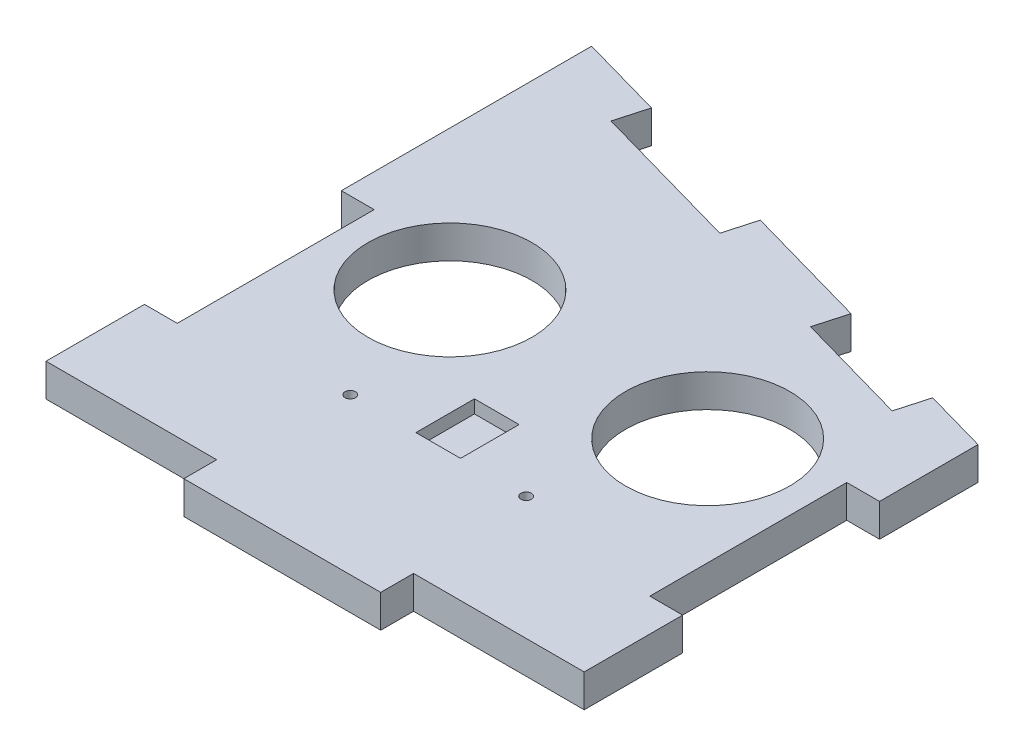
from build123d import *

# Parameters (mm, degrees)
SKETCH1_R           = 7.9375
BOSS_EXTRUDE1_DEPTH = 3.175
SKETCH2_W           = 4.318
SKETCH2_H           = 5.6642
CUT_EXTRUDE1_DEPTH  = 1.27
SKETCH3_R           = 0.508
CUT_EXTRUDE2_DEPTH  = 75.215587445


with BuildPart() as part:
    # Sketch1 → Boss-Extrude1 (new body)
    with BuildSketch(Plane(origin=(0, 0, 0), x_dir=(1, 0, 0), z_dir=(0, 1, 0))):
        Polygon((0, 0), (16.51, 0), (16.51, -3.175), (35.56, -3.175), (35.56, 0), (52.07, 0), (52.07, 9.525), (48.895, 9.525), (48.895, 28.575), (52.07, 28.575), (52.07, 38.1), (45.958497653, 39.823960283), (45.096517511, 36.768209109), (34.095813286, 39.871337619), (34.957793427, 42.927088793), (22.734788732, 46.375009359), (21.872808591, 43.319258185), (7.205202957, 47.456762864), (8.067183099, 50.512514038), (0, 52.788141612), (0, 28.575), (3.175, 28.575), (3.175, 9.525), (0, 9.525), align=None)
        with Locations(Location((13.56995, 25.512426191, 0), (0, 0, 270))):
            Circle(SKETCH1_R, mode=Mode.SUBTRACT)
        with Locations(Location((38.50005, 25.512426191, 0), (0, 0, 270))):
            Circle(SKETCH1_R, mode=Mode.SUBTRACT)
    extrude(amount=BOSS_EXTRUDE1_DEPTH)

    # Sketch2 → Cut-Extrude1 (cut)
    with BuildSketch(Plane(origin=(0, 3.175, 0), x_dir=(1, 0, 0), z_dir=(0, 1, 0))):
        with Locations((26.035, 14.742826191)):
            Rectangle(SKETCH2_W, SKETCH2_H)
    extrude(amount=-CUT_EXTRUDE1_DEPTH, mode=Mode.SUBTRACT)

    # Sketch3 → Cut-Extrude2 (cut, through all)
    with BuildSketch(Plane(origin=(0, 3.175, 0), x_dir=(1, 0, 0), z_dir=(0, 1, 0))):
        with Locations(Location((17.526, 11.910726191, 0), (0, 0, 270))):
            Circle(SKETCH3_R)
        with Locations(Location((34.544, 11.910726191, 0), (0, 0, 270))):
            Circle(SKETCH3_R)
    extrude(amount=-CUT_EXTRUDE2_DEPTH, mode=Mode.SUBTRACT)


solid = part.part
